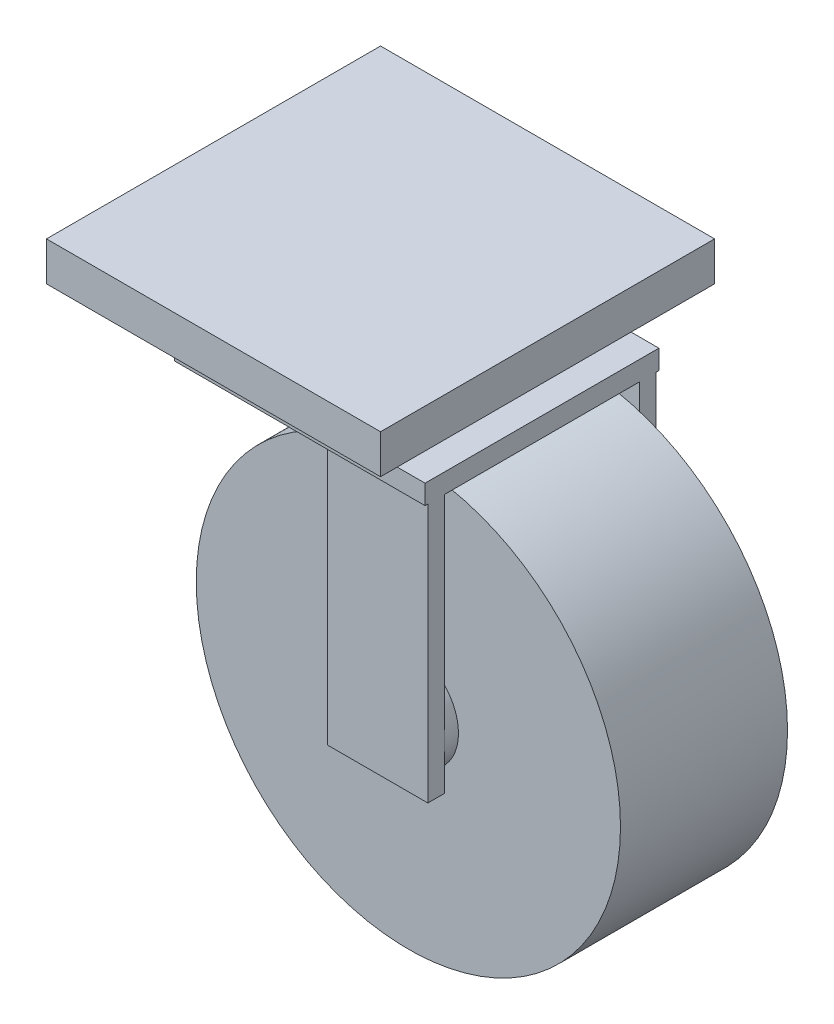
from build123d import *

# Parameters (mm, degrees)
P01_SPACER4MM_START  = 89
SK_P01_SPACER4MM_W   = 60
SK_P01_SPACER4MM_H   = 60
P01_SPACER4MM_DEPTH  = 4
P02_TOPPLATE_START   = 86
SK_P02_TOPPLATE_W    = 60
SK_P02_TOPPLATE_H    = 60
P02_TOPPLATE_DEPTH   = 3
P03_SWIVELRACE_START = 80
SK_P03_SWIVELRACE_R  = 22
P03_SWIVELRACE_DEPTH = 6
P04_FORKYOKE_START   = 76.5
SK_P04_FORKYOKE_W    = 45
SK_P04_FORKYOKE_H    = 42
P04_FORKYOKE_DEPTH   = 3.5
P05_FORKLEG_START    = 30
SK_P05_FORKLEG_W     = 18
SK_P05_FORKLEG_H     = 3
P05_FORKLEG_DEPTH    = 48
P06_FORKLEG_START    = 30
SK_P06_FORKLEG_W     = 18
SK_P06_FORKLEG_H     = 3
P06_FORKLEG_DEPTH    = 48
P07_WHEEL3IN_START   = -15
SK_P07_WHEEL3IN_R    = 38.1
P07_WHEEL3IN_DEPTH   = 30
P08_AXLE_START       = -17.5
SK_P08_AXLE_R        = 9
P08_AXLE_DEPTH       = 35


with BuildPart() as part:
    # SK_P01_Spacer4mm → P01_Spacer4mm (new body)
    with BuildSketch(Plane(origin=(0, 0, 0), x_dir=(1, 0, 0), z_dir=(0, 1, 0)).offset(P01_SPACER4MM_START)):
        with Locations((-14.05, 0)):
            Rectangle(SK_P01_SPACER4MM_W, SK_P01_SPACER4MM_H)
    extrude(amount=P01_SPACER4MM_DEPTH)

    # SK_P02_Topplate → P02_Topplate (add)
    with BuildSketch(Plane(origin=(0, 0, 0), x_dir=(1, 0, 0), z_dir=(0, 1, 0)).offset(P02_TOPPLATE_START)):
        with Locations((-14.05, 0)):
            Rectangle(SK_P02_TOPPLATE_W, SK_P02_TOPPLATE_H)
    extrude(amount=P02_TOPPLATE_DEPTH)

    # SK_P03_Swivelrace → P03_Swivelrace (add)
    with BuildSketch(Plane(origin=(0, 0, 0), x_dir=(1, 0, 0), z_dir=(0, 1, 0)).offset(P03_SWIVELRACE_START)):
        with Locations(Location((-14.05, 0, 0), (0, 0, 270))):
            Circle(SK_P03_SWIVELRACE_R)
    extrude(amount=P03_SWIVELRACE_DEPTH)

    # SK_P04_Forkyoke → P04_Forkyoke (add)
    with BuildSketch(Plane(origin=(0, 0, 0), x_dir=(1, 0, 0), z_dir=(0, 1, 0)).offset(P04_FORKYOKE_START)):
        with Locations((-7.55, 0)):
            Rectangle(SK_P04_FORKYOKE_W, SK_P04_FORKYOKE_H)
    extrude(amount=P04_FORKYOKE_DEPTH)

    # SK_P05_Forkleg → P05_Forkleg (add)
    with BuildSketch(Plane(origin=(0, 0, 0), x_dir=(1, 0, 0), z_dir=(0, 1, 0)).offset(P05_FORKLEG_START)):
        with Locations((5.95, 19)):
            Rectangle(SK_P05_FORKLEG_W, SK_P05_FORKLEG_H)
    extrude(amount=P05_FORKLEG_DEPTH)

    # SK_P06_Forkleg → P06_Forkleg (add)
    with BuildSketch(Plane(origin=(0, 0, 0), x_dir=(1, 0, 0), z_dir=(0, 1, 0)).offset(P06_FORKLEG_START)):
        with Locations((5.95, -19)):
            Rectangle(SK_P06_FORKLEG_W, SK_P06_FORKLEG_H)
    extrude(amount=P06_FORKLEG_DEPTH)



with BuildPart() as body_2:
    # SK_P07_Wheel3in → P07_Wheel3in (new body)
    with BuildSketch(Plane.XY.offset(P07_WHEEL3IN_START)):
        with Locations((5.95, 38.1)):
            Circle(SK_P07_WHEEL3IN_R)
    extrude(amount=P07_WHEEL3IN_DEPTH)


with BuildPart() as part_1:
    add(part.part)

    add(body_2.part)  # P08_Axle merges body 2
    # SK_P08_Axle → P08_Axle (add)
    with BuildSketch(Plane.XY.offset(P08_AXLE_START)):
        with Locations((5.95, 38.1)):
            Circle(SK_P08_AXLE_R)
    extrude(amount=P08_AXLE_DEPTH)


solid = part_1.part
